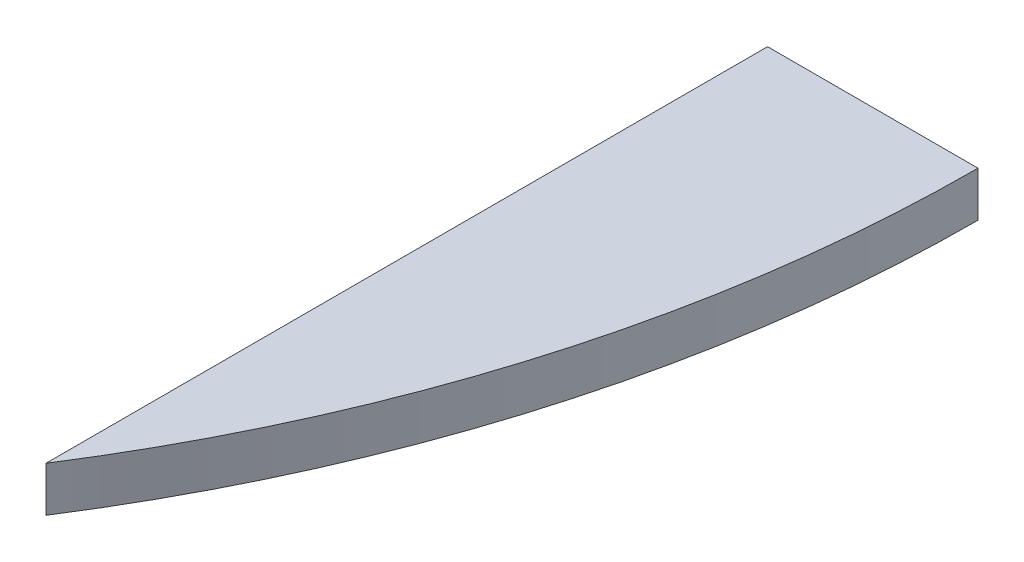
from build123d import *

# Parameters (mm, degrees)
BOSS_EXTRUDE1_DEPTH = 3


with BuildPart() as part:
    # Sketch1 → Boss-Extrude1 (new body)
    with BuildSketch(Plane(origin=(0, 0, 0), x_dir=(1, 0, 0), z_dir=(0, 1, 0))):
        with BuildLine():
            Line((0, 0), (0, 48))
            Line((0, 48), (14, 48))
            ThreePointArc((14, 48), (10.428571429, 23), (0, 0))
        make_face()
    extrude(amount=BOSS_EXTRUDE1_DEPTH)


solid = part.part
